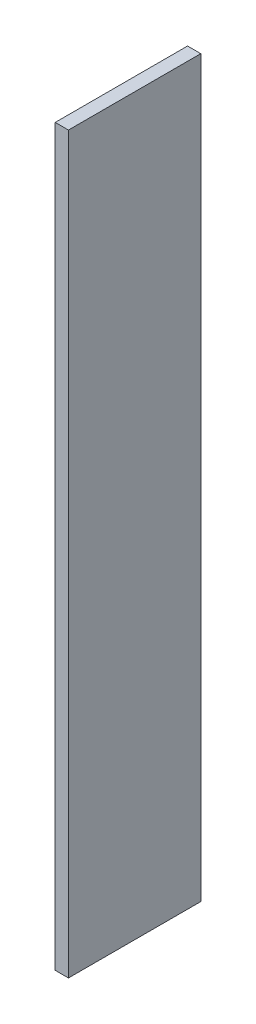
from build123d import *

# Parameters (mm, degrees)
SKETCH1_W           = 20
SKETCH1_H           = 111
BOSS_EXTRUDE1_DEPTH = 1


with BuildPart() as part:
    # Sketch1 → Boss-Extrude1 (new, symmetric)
    with BuildSketch(Plane(origin=(0, 0, 0), x_dir=(0, 0, -1), z_dir=(1, 0, 0))):
        Rectangle(SKETCH1_W, SKETCH1_H)
    extrude(amount=BOSS_EXTRUDE1_DEPTH, both=True)


solid = part.part
